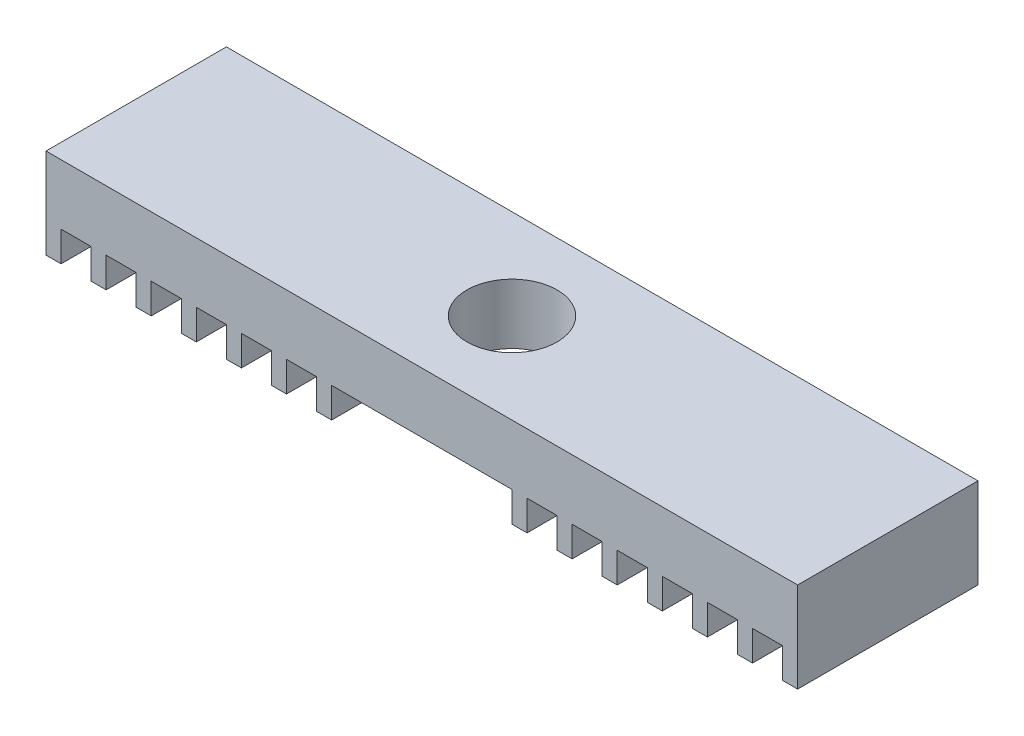
from build123d import *

# Parameters (mm, degrees)
SKETCH1_W           = 0.79375
SKETCH1_H           = 1.5875
SKETCH1_W_2         = 39.6875
SKETCH1_H_2         = 3.175
BOSS_EXTRUDE1_DEPTH = 9.525
SKETCH2_R           = 2.38125
CUT_EXTRUDE1_DEPTH  = 9.525


with BuildPart() as part:
    # Sketch1 → Boss-Extrude1 (new body)
    with BuildSketch(Plane.XY):
        with Locations((-19.446875, -2.38125)):
            Rectangle(SKETCH1_W, SKETCH1_H)
        with Locations((-17.065625, -2.38125)):
            Rectangle(SKETCH1_W, SKETCH1_H)
        with Locations((-14.684375, -2.38125)):
            Rectangle(SKETCH1_W, SKETCH1_H)
        with Locations((-12.303125, -2.38125)):
            Rectangle(SKETCH1_W, SKETCH1_H)
        with Locations((-9.921875, -2.38125)):
            Rectangle(SKETCH1_W, SKETCH1_H)
        with Locations((-7.540625, -2.38125)):
            Rectangle(SKETCH1_W, SKETCH1_H)
        with Locations((-5.159375, -2.38125)):
            Rectangle(SKETCH1_W, SKETCH1_H)
        with Locations((5.159375, -2.38125)):
            Rectangle(SKETCH1_W, SKETCH1_H)
        with Locations((7.540625, -2.38125)):
            Rectangle(SKETCH1_W, SKETCH1_H)
        with Locations((9.921875, -2.38125)):
            Rectangle(SKETCH1_W, SKETCH1_H)
        with Locations((12.303125, -2.38125)):
            Rectangle(SKETCH1_W, SKETCH1_H)
        with Locations((14.684375, -2.38125)):
            Rectangle(SKETCH1_W, SKETCH1_H)
        with Locations((17.065625, -2.38125)):
            Rectangle(SKETCH1_W, SKETCH1_H)
        with Locations((19.446875, -2.38125)):
            Rectangle(SKETCH1_W, SKETCH1_H)
        Rectangle(SKETCH1_W_2, SKETCH1_H_2)
    extrude(amount=BOSS_EXTRUDE1_DEPTH)

    # Sketch2 → Cut-Extrude1 (cut)
    with BuildSketch(Plane(origin=(0, 1.5875, 0), x_dir=(1, 0, 0), z_dir=(0, 1, 0))):
        with Locations(Location((0, -4.7625, 0), (0, 0, 270))):
            Circle(SKETCH2_R)
    extrude(amount=-CUT_EXTRUDE1_DEPTH, mode=Mode.SUBTRACT)


solid = part.part
